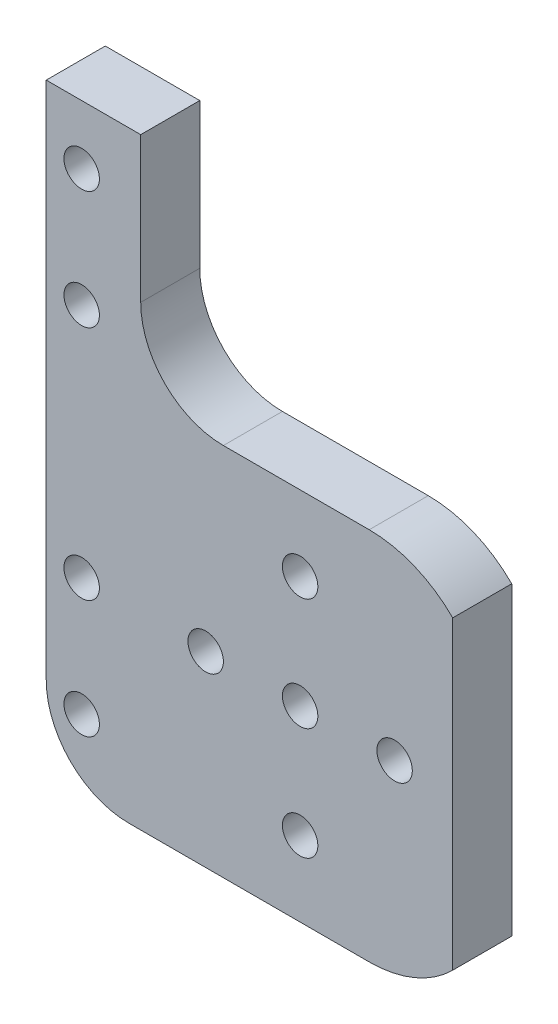
from build123d import *

# Parameters (mm, degrees)
CROQUIS1_R              = 1.5
SALIENTE_EXTRUIR1_DEPTH = 5


with BuildPart() as part:
    # Croquis1 → Saliente-Extruir1 (new body)
    with BuildSketch(Plane.XY):
        with BuildLine():
            Line((-28.790532902, 40.226856436), (-28.790532902, 20.926856436))
            Line((-28.790532902, 20.926856436), (-28.790532902, -0.073143564))
            Line((-28.790532902, -0.073143564), (-28.790532902, -3.773143564))
            ThreePointArc((-28.790532902, -3.773143564), (-26.740280371, -8.722891033), (-21.790532902, -10.773143564))
            Line((-21.790532902, -10.773143564), (-1.440532902, -10.773143564))
            ThreePointArc((-1.440532902, -10.773143564), (2.386301421, -10.011938889), (5.630534909, -7.844211376))
            Line((5.630534909, -7.844211376), (5.630534909, 17.997924248))
            ThreePointArc((5.630534909, 17.997924248), (2.386301421, 20.165651761), (-1.440532902, 20.926856436))
            Line((-1.440532902, 20.926856436), (-13.790532902, 20.926856436))
            ThreePointArc((-13.790532902, 20.926856436), (-18.740280371, 22.977108967), (-20.790532902, 27.926856436))
            Line((-20.790532902, 27.926856436), (-20.790532902, 40.226856436))
            Line((-20.790532902, 40.226856436), (-28.790532902, 40.226856436))
        make_face()
        with Locations((-25.790532902, -4.773143564)):
            Circle(CROQUIS1_R, mode=Mode.SUBTRACT)
        with Locations((-25.790532902, 5.226856436)):
            Circle(CROQUIS1_R, mode=Mode.SUBTRACT)
        with Locations((-15.290532902, 5.076856436)):
            Circle(CROQUIS1_R, mode=Mode.SUBTRACT)
        with Locations((-7.290532902, -4.423143564)):
            Circle(CROQUIS1_R, mode=Mode.SUBTRACT)
        with Locations((-7.290532902, 5.076856436)):
            Circle(CROQUIS1_R, mode=Mode.SUBTRACT)
        with Locations((-7.290532902, 14.576856436)):
            Circle(CROQUIS1_R, mode=Mode.SUBTRACT)
        with Locations((0.709467098, 5.076856436)):
            Circle(CROQUIS1_R, mode=Mode.SUBTRACT)
        with Locations((-25.790532902, 25.226856436)):
            Circle(CROQUIS1_R, mode=Mode.SUBTRACT)
        with Locations((-25.790532902, 35.226856436)):
            Circle(CROQUIS1_R, mode=Mode.SUBTRACT)
    extrude(amount=SALIENTE_EXTRUIR1_DEPTH)


solid = part.part
